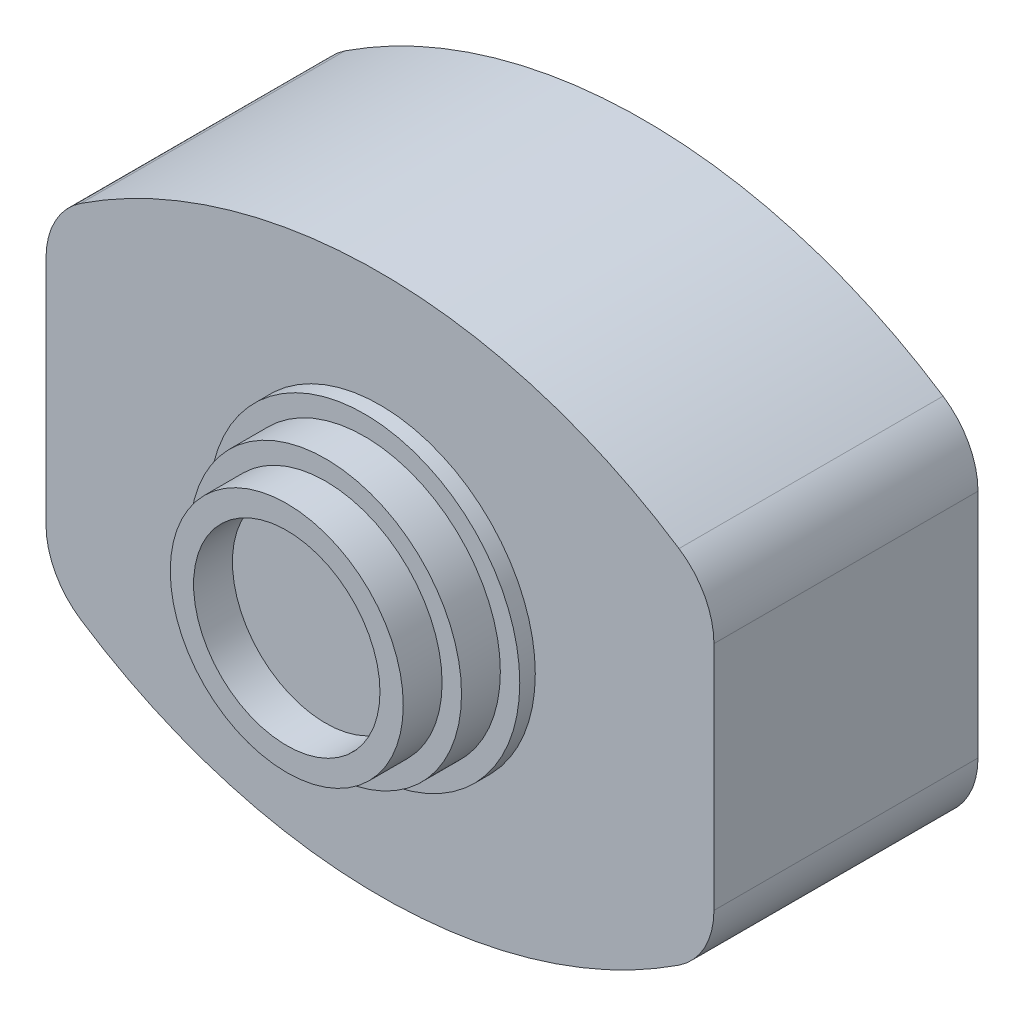
from build123d import *

# Parameters (mm, degrees)
BOSS_EXTRUDE1_DEPTH = 34
SKETCH2_R           = 20
BOSS_EXTRUDE2_DEPTH = 2
SKETCH3_R           = 17.5
BOSS_EXTRUDE3_DEPTH = 5
SKETCH4_R           = 15
BOSS_EXTRUDE4_DEPTH = 5
SKETCH5_R           = 12
CUT_EXTRUDE1_DEPTH  = 5
CUT_EXTRUDE2_DEPTH  = 5
SKETCH10_W          = 3.955735376
SKETCH10_H          = 3.547567536
BOSS_EXTRUDE5_DEPTH = 5


with BuildPart() as part:
    # Sketch1 → Boss-Extrude1 (new body)
    with BuildSketch(Plane.XY):
        with BuildLine():
            Line((86, 5.125978653), (86, 34.874021347))
            ThreePointArc((86, 34.874021347), (84.803408431, 39.617437837), (81.5, 43.225667891))
            ThreePointArc((81.5, 43.225667891), (43, 54.764142081), (4.5, 43.225667891))
            ThreePointArc((4.5, 43.225667891), (1.196591569, 39.617437837), (0, 34.874021347))
            Line((0, 34.874021347), (0, 5.125978653))
            ThreePointArc((0, 5.125978653), (1.196591569, 0.382562163), (4.5, -3.225667891))
            ThreePointArc((4.5, -3.225667891), (43, -14.764142081), (81.5, -3.225667891))
            ThreePointArc((81.5, -3.225667891), (84.803408431, 0.382562163), (86, 5.125978653))
        make_face()
    extrude(amount=BOSS_EXTRUDE1_DEPTH)

    # Sketch2 → Boss-Extrude2 (add)
    with BuildSketch(Plane.XY.offset(34)):
        with Locations((43, 20)):
            Circle(SKETCH2_R)
    extrude(amount=BOSS_EXTRUDE2_DEPTH)

    # Sketch3 → Boss-Extrude3 (add)
    with BuildSketch(Plane.XY.offset(36)):
        with Locations((43, 20)):
            Circle(SKETCH3_R)
    extrude(amount=BOSS_EXTRUDE3_DEPTH)

    # Sketch4 → Boss-Extrude4 (add)
    with BuildSketch(Plane.XY.offset(41)):
        with Locations((43, 20)):
            Circle(SKETCH4_R)
    extrude(amount=BOSS_EXTRUDE4_DEPTH)

    # Sketch5 → Cut-Extrude1 (cut)
    with BuildSketch(Plane.XY.offset(46)):
        with Locations((43, 20)):
            Circle(SKETCH5_R)
    extrude(amount=-CUT_EXTRUDE1_DEPTH, mode=Mode.SUBTRACT)

    # Sketch9 → Cut-Extrude2 (cut)
    with BuildSketch(Plane(origin=(0, -14.764142081, 0), x_dir=(-1, 0, 0), z_dir=(0, -1, 0))):
        Polygon((-43, -13.35), (-47.25, -13.35), (-47.25, -19.65), (-46.25, -20.65), (-43, -20.65), (-39.75, -20.65), (-38.75, -19.65), (-38.75, -13.35), align=None)
    extrude(amount=-CUT_EXTRUDE2_DEPTH, mode=Mode.SUBTRACT)

    # Sketch10 → Boss-Extrude5 (add)
    with BuildSketch(Plane(origin=(0, -9.764142081, 0), x_dir=(-1, 0, 0), z_dir=(0, -1, 0))):
        with Locations((-43, -17)):
            Rectangle(SKETCH10_W, SKETCH10_H)
    extrude(amount=BOSS_EXTRUDE5_DEPTH)


solid = part.part
